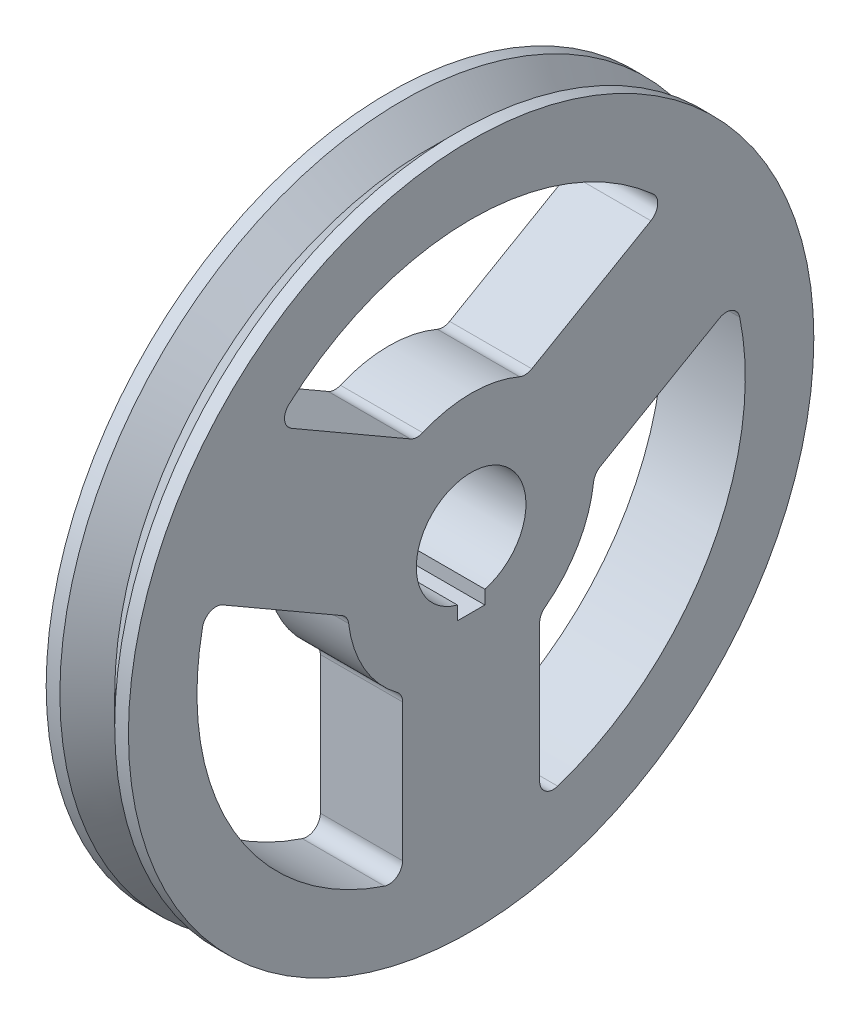
from build123d import *

# Parameters (mm, degrees)
SKETCH1_W           = 30
SKETCH1_H           = 25
BOSS_EXTRUDE1_DEPTH = 15
CUT_EXTRUDE1_DEPTH  = 180.30421077


with BuildPart() as part:
    # Sketch1 → Revolve1 (revolve)
    with BuildSketch(Plane(origin=(0, 0, 0), x_dir=(1, 0, 0), z_dir=(0, 1, 0)), mode=Mode.PRIVATE) as revolve1_sk:
        Polygon((-15, 125), (-15, 100), (15, 100), (15, 125), (10, 125), (0, 115), (-10, 125), align=None)
        with Locations((0, 32.5)):
            Rectangle(SKETCH1_W, SKETCH1_H)
    revolve(revolve1_sk.sketch.rotate(Axis((0, 0, 0), (1, 0, 0)), 180), axis=Axis((0, 0, 0), (1, 0, 0)))

    # Sketch2 → Boss-Extrude1 (add, symmetric)
    with BuildSketch(Plane(origin=(0, 0, 0), x_dir=(0, 0, -1), z_dir=(1, 0, 0))):
        with BuildLine():
            Line((25, -90.138781887), (25, -40))
            ThreePointArc((25, -40), (25.527864045, -37.763932023), (27, -36))
            ThreePointArc((27, -36), (0, -45), (-27, -36))
            ThreePointArc((-27, -36), (-25.527864045, -37.763932023), (-25, -40))
            Line((-25, -40), (-25, -90.138781887))
            ThreePointArc((-25, -90.138781887), (-27.075511741, -94.194317415), (-31.578947368, -94.882928302))
            ThreePointArc((-31.578947368, -94.882928302), (0, -100), (31.578947368, -94.882928302))
            ThreePointArc((31.578947368, -94.882928302), (27.075511741, -94.194317415), (25, -90.138781887))
        make_face()
        with BuildLine():
            ThreePointArc((17.676914536, 41.382685902), (38.97114317, 22.5), (44.676914536, -5.382685902))
            ThreePointArc((44.676914536, -5.382685902), (45.468456501, -3.225812756), (47.141016151, -1.650635095))
            Line((47.141016151, -1.650635095), (90.56247498, 23.418755849))
            ThreePointArc((90.56247498, 23.418755849), (95.112427644, 23.64907772), (97.960499979, 20.093293505))
            ThreePointArc((97.960499979, 20.093293505), (86.602540378, 50), (66.381552611, 74.789634797))
            ThreePointArc((66.381552611, 74.789634797), (68.036915903, 70.545239695), (65.56247498, 66.720026038))
            Line((65.56247498, 66.720026038), (22.141016151, 41.650635095))
            ThreePointArc((22.141016151, 41.650635095), (19.940592456, 40.989744779), (17.676914536, 41.382685902))
        make_face()
        with BuildLine():
            ThreePointArc((-47.141016151, -1.650635095), (-45.468456501, -3.225812756), (-44.676914536, -5.382685902))
            ThreePointArc((-44.676914536, -5.382685902), (-38.97114317, 22.5), (-17.676914536, 41.382685902))
            ThreePointArc((-17.676914536, 41.382685902), (-19.940592456, 40.989744779), (-22.141016151, 41.650635095))
            Line((-22.141016151, 41.650635095), (-65.56247498, 66.720026038))
            ThreePointArc((-65.56247498, 66.720026038), (-68.036915903, 70.545239695), (-66.381552611, 74.789634797))
            ThreePointArc((-66.381552611, 74.789634797), (-86.602540378, 50), (-97.960499979, 20.093293505))
            ThreePointArc((-97.960499979, 20.093293505), (-95.112427644, 23.64907772), (-90.56247498, 23.418755849))
            Line((-90.56247498, 23.418755849), (-47.141016151, -1.650635095))
        make_face()
    extrude(amount=BOSS_EXTRUDE1_DEPTH, both=True)

    # Sketch4 → Cut-Extrude1 (cut, through all)
    with BuildSketch(Plane.ZY.offset(15)):
        with BuildLine():
            Line((5, -24.364916731), (5, -19.364916731))
            ThreePointArc((5, -19.364916731), (0, -20), (-5, -19.364916731))
            Line((-5, -19.364916731), (-5, -24.364916731))
            Line((-5, -24.364916731), (5, -24.364916731))
        make_face()
    extrude(amount=-CUT_EXTRUDE1_DEPTH, mode=Mode.SUBTRACT)


solid = part.part
